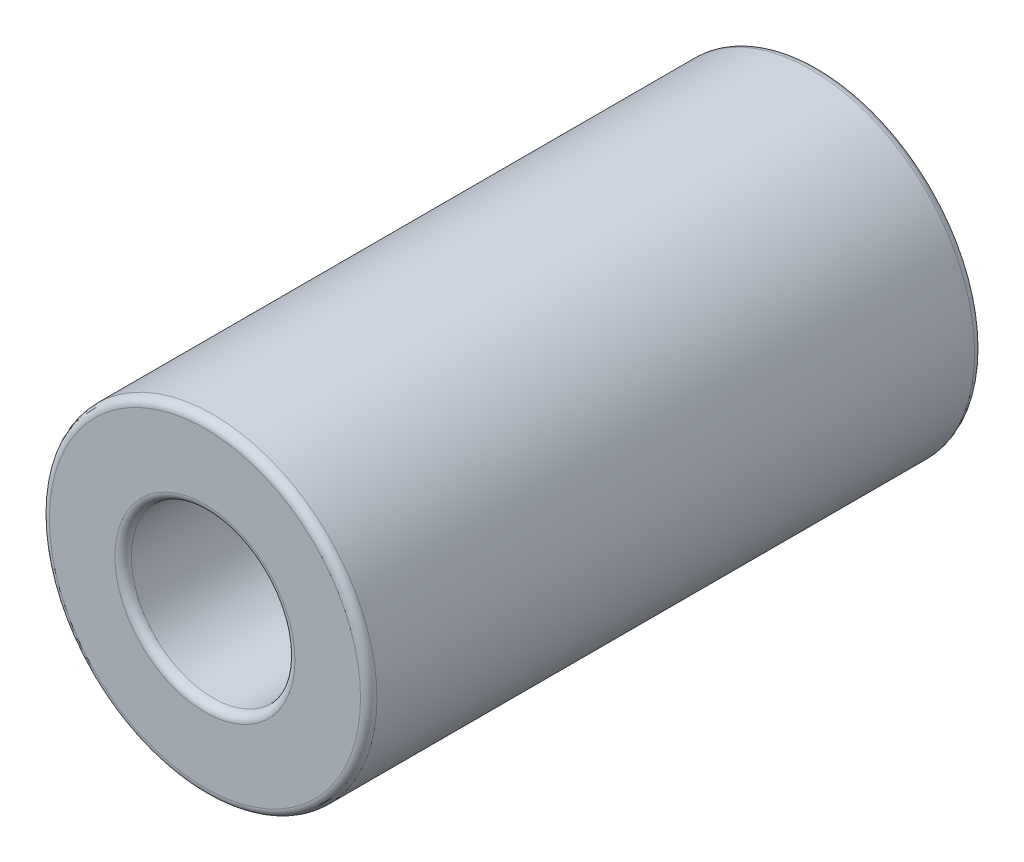
from build123d import *

# Parameters (mm, degrees)
SKETCH_1_R      = 4
SKETCH_1_R_2    = 2
EXTRUDE_1_DEPTH = 15
FILLET_1_R      = 0.2


with BuildPart() as part:
    # 草图1 → 凸台-拉伸1 (new body)
    with BuildSketch(Plane.XY):
        Circle(SKETCH_1_R)
        Circle(SKETCH_1_R_2, mode=Mode.SUBTRACT)
    extrude(amount=-EXTRUDE_1_DEPTH)

    # 圆角1
    fillet_1_edges = [part.edges().sort_by_distance(p)[0] for p in [
        (-4, 0, 0),
        (-4, 0, -15),
        (-2, 0, -15),
        (-2, 0, 0),
    ]]
    fillet(fillet_1_edges, radius=FILLET_1_R)


solid = part.part
